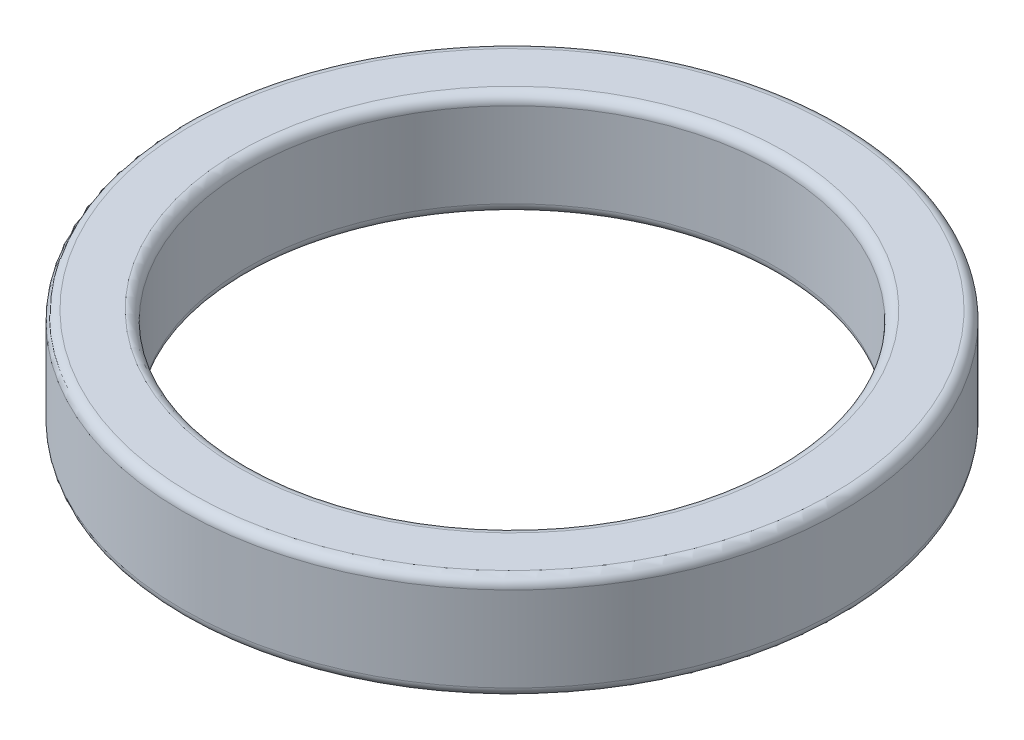
from build123d import *

# Parameters (mm, degrees)
SKETCH1_R           = 5
SKETCH1_R_2         = 4
BOSS_EXTRUDE1_DEPTH = 1.5875
FILLET1_R           = 0.15


with BuildPart() as part:
    # Sketch1 → Boss-Extrude1 (new body)
    with BuildSketch(Plane(origin=(0, 0, 0), x_dir=(1, 0, 0), z_dir=(0, 1, 0))):
        with Locations(Location((0, 0, 0), (0, 0, 270))):
            Circle(SKETCH1_R)
        with Locations(Location((0, 0, 0), (0, 0, 270))):
            Circle(SKETCH1_R_2, mode=Mode.SUBTRACT)
    extrude(amount=BOSS_EXTRUDE1_DEPTH)

    # Fillet1
    fillet1_edges = [part.edges().sort_by_distance(p)[0] for p in [
        (0, 0, -5),
        (0, 1.5875, -5),
        (0, 0, -4),
        (0, 1.5875, -4),
    ]]
    fillet(fillet1_edges, radius=FILLET1_R)


solid = part.part
